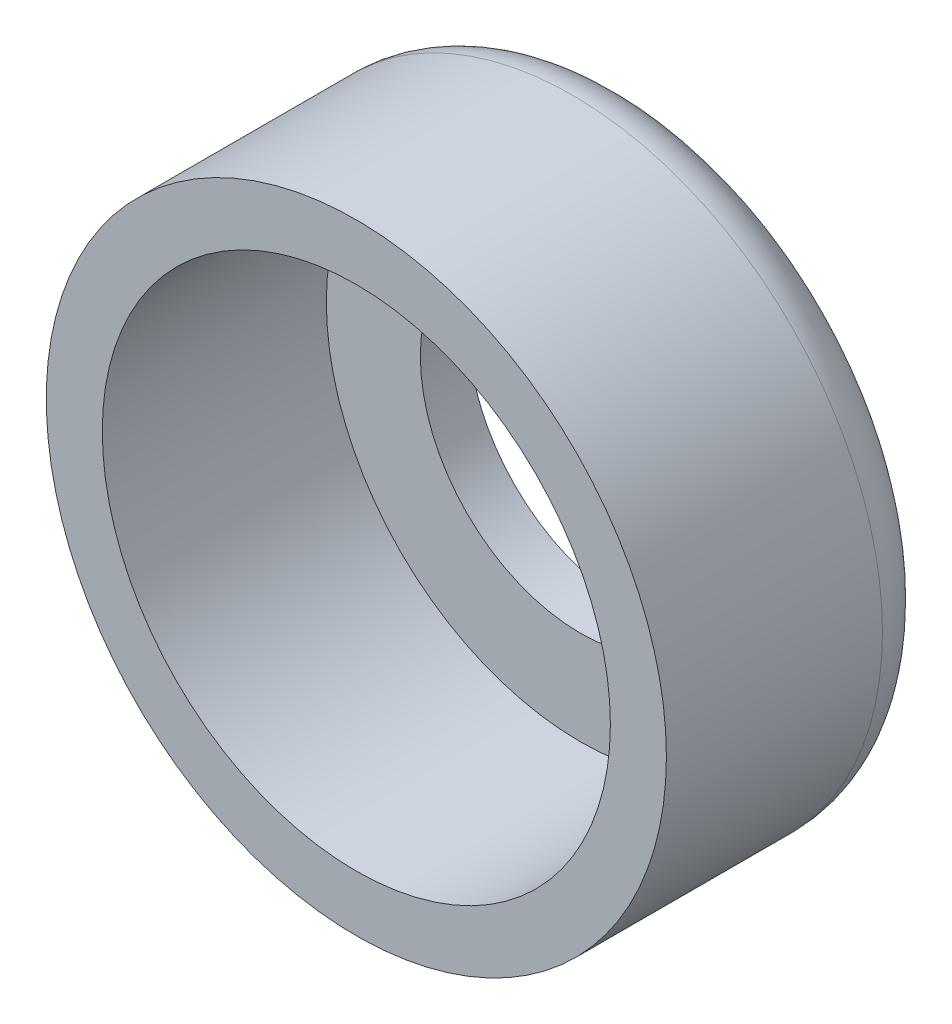
from build123d import *

# Parameters (mm, degrees)
SKETCH1_R           = 3.875
SKETCH1_R_2         = 2
BOSS_EXTRUDE1_DEPTH = 0.6
SKETCH2_R           = 3.875
SKETCH2_R_2         = 3.175
BOSS_EXTRUDE2_DEPTH = 2.8
FILLET1_R           = 0.7


with BuildPart() as part:
    # Sketch1 → Boss-Extrude1 (new body)
    with BuildSketch(Plane(origin=(0, 0, 0), x_dir=(0, 1, 0), z_dir=(0, 0, 1))):
        Circle(SKETCH1_R)
        Circle(SKETCH1_R_2, mode=Mode.SUBTRACT)
    extrude(amount=BOSS_EXTRUDE1_DEPTH)

    # Sketch2 → Boss-Extrude2 (add)
    with BuildSketch(Plane.XY.offset(0.6)):
        Circle(SKETCH2_R)
        Circle(SKETCH2_R_2, mode=Mode.SUBTRACT)
    extrude(amount=BOSS_EXTRUDE2_DEPTH)

    # Fillet1
    fillet1_edges = [part.edges().sort_by_distance(p)[0] for p in [
        (0, -3.875, 0),
    ]]
    fillet(fillet1_edges, radius=FILLET1_R)


solid = part.part
